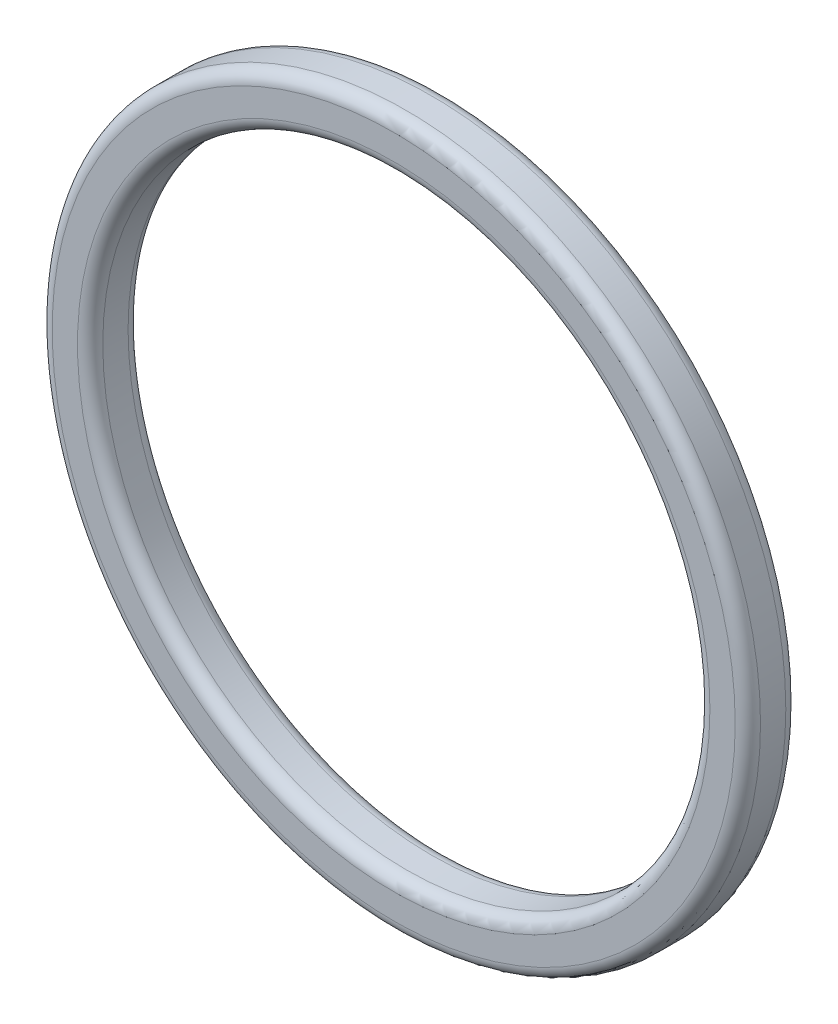
from build123d import *

# Parameters (mm, degrees)
SKETCH1_R           = 7
SKETCH1_R_2         = 6
BOSS_EXTRUDE1_DEPTH = 1
FILLET1_R           = 0.25
FILLET2_R           = 0.25


with BuildPart() as part:
    # Sketch1 → Boss-Extrude1 (new body)
    with BuildSketch(Plane.XY):
        Circle(SKETCH1_R)
        Circle(SKETCH1_R_2, mode=Mode.SUBTRACT)
    extrude(amount=BOSS_EXTRUDE1_DEPTH)

    # Fillet1
    fillet1_edges = [part.edges().sort_by_distance(p)[0] for p in [
        (-7, 0, 0),
        (-6, 0, 0),
    ]]
    fillet(fillet1_edges, radius=FILLET1_R)

    # Fillet2
    fillet2_edges = [part.edges().sort_by_distance(p)[0] for p in [
        (-7, 0, 1),
        (-6, 0, 1),
    ]]
    fillet(fillet2_edges, radius=FILLET2_R)


solid = part.part
